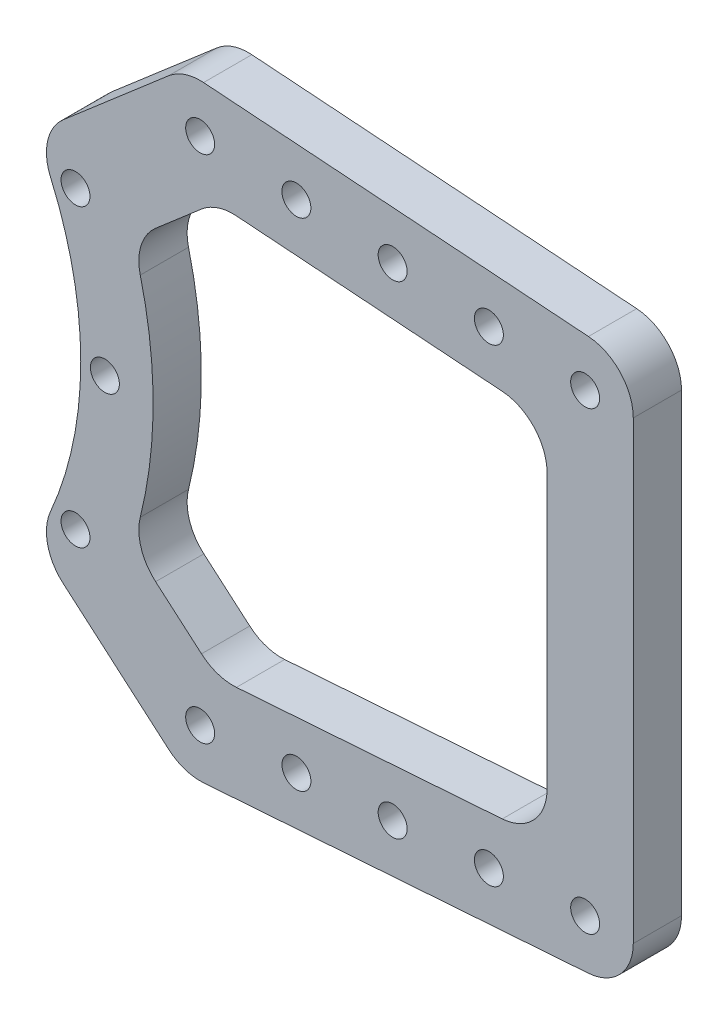
from build123d import *

# Parameters (mm, degrees)
EXTRUDE_1_DEPTH     = 15
FILLET_1_R          = 5
FILLET_2_R          = 5
FILLET_3_R          = 5
FILLET_4_R          = 5
FILLET_5_R          = 5
FILLET_6_R          = 5
FILLET_7_R          = 5
FILLET_8_R          = 5
FILLET_9_R          = 5
FILLET_10_R         = 5
FILLET_11_R         = 5
FILLET_12_R         = 5
FILLET_13_R         = 5
FILLET_14_R         = 5
FILLET_15_R         = 5
FILLET_16_R         = 5
SKETCH_5_R          = 1.5
CUT_EXTRUDE_1_DEPTH = 15
CUT_EXTRUDE_START   = -15
SKETCH_6_R          = 1.5
CUT_EXTRUDE_5_DEPTH = 15
EXTRUDE_2_DEPTH     = 15
FILLET_17_R         = 5
FILLET_18_R         = 5
FILLET_19_R         = 5
FILLET_20_R         = 5
SKETCH_8_W          = 96.520141499
SKETCH_8_H          = 72.316132992
CUT_EXTRUDE_6_DEPTH = 5
SKETCH_9_W          = 91.216327174
SKETCH_9_H          = 79.967676963
CUT_EXTRUDE_7_DEPTH = 5


with BuildPart() as part:
    # 草图3 → 凸台-拉伸1 (new body)
    with BuildSketch(Plane.XY):
        with BuildLine():
            Line((101.99145665, -27.727634828), (114.18506552, -15.283623844))
            ThreePointArc((114.18506552, -15.283623844), (110, 0), (114.18506552, 15.283623844))
            Line((114.18506552, 15.283623844), (101.99145665, 27.727634828))
            Line((101.99145665, 27.727634828), (48.171786379, 31.57189699))
            Line((48.171786379, 31.57189699), (32.743622368, 18.278544642))
            ThreePointArc((32.743622368, 18.278544642), (37.5, 0), (32.743622368, -18.278544642))
            Line((32.743622368, -18.278544642), (48.171786379, -31.57189699))
            Line((48.171786379, -31.57189699), (101.99145665, -27.727634828))
        make_face()
        with BuildLine():
            ThreePointArc((42.839131819, -13.777110909), (45, 0), (42.839131819, 13.777110909))
            Line((42.839131819, 13.777110909), (51.574083604, 21.303398011))
            Line((51.574083604, 21.303398011), (97.500283316, 18.022955175))
            Line((97.500283316, 18.022955175), (106.212331228, 9.132000819))
            ThreePointArc((106.212331228, 9.132000819), (105, 0), (106.212331228, -9.132000819))
            Line((106.212331228, -9.132000819), (97.500283316, -18.022955175))
            Line((97.500283316, -18.022955175), (51.574083604, -21.303398011))
            Line((51.574083604, -21.303398011), (42.839131819, -13.777110909))
        make_face(mode=Mode.SUBTRACT)
    extrude(amount=EXTRUDE_1_DEPTH)

    # 圆角1
    fillet_1_edges = [part.edges().sort_by_distance(p)[0] for p in [
        (101.99145665, 27.727634828, 7.5),
    ]]
    fillet(fillet_1_edges, radius=FILLET_1_R)

    # 圆角2
    fillet_2_edges = [part.edges().sort_by_distance(p)[0] for p in [
        (114.18506552, 15.283623844, 7.5),
    ]]
    fillet(fillet_2_edges, radius=FILLET_2_R)

    # 圆角3
    fillet_3_edges = [part.edges().sort_by_distance(p)[0] for p in [
        (114.18506552, -15.283623844, 7.5),
    ]]
    fillet(fillet_3_edges, radius=FILLET_3_R)

    # 圆角4
    fillet_4_edges = [part.edges().sort_by_distance(p)[0] for p in [
        (101.99145665, -27.727634828, 7.5),
    ]]
    fillet(fillet_4_edges, radius=FILLET_4_R)

    # 圆角5
    fillet_5_edges = [part.edges().sort_by_distance(p)[0] for p in [
        (48.171786379, -31.57189699, 7.5),
    ]]
    fillet(fillet_5_edges, radius=FILLET_5_R)

    # 圆角6
    fillet_6_edges = [part.edges().sort_by_distance(p)[0] for p in [
        (48.171786379, 31.57189699, 7.5),
    ]]
    fillet(fillet_6_edges, radius=FILLET_6_R)

    # 圆角7
    fillet_7_edges = [part.edges().sort_by_distance(p)[0] for p in [
        (32.743622368, -18.278544642, 7.5),
    ]]
    fillet(fillet_7_edges, radius=FILLET_7_R)

    # 圆角8
    fillet_8_edges = [part.edges().sort_by_distance(p)[0] for p in [
        (32.743622368, 18.278544642, 7.5),
    ]]
    fillet(fillet_8_edges, radius=FILLET_8_R)

    # 圆角9
    fillet_9_edges = [part.edges().sort_by_distance(p)[0] for p in [
        (97.500283316, -18.022955175, 7.5),
    ]]
    fillet(fillet_9_edges, radius=FILLET_9_R)

    # 圆角10
    fillet_10_edges = [part.edges().sort_by_distance(p)[0] for p in [
        (106.212331228, -9.132000819, 7.5),
    ]]
    fillet(fillet_10_edges, radius=FILLET_10_R)

    # 圆角11
    fillet_11_edges = [part.edges().sort_by_distance(p)[0] for p in [
        (106.212331228, 9.132000819, 7.5),
    ]]
    fillet(fillet_11_edges, radius=FILLET_11_R)

    # 圆角12
    fillet_12_edges = [part.edges().sort_by_distance(p)[0] for p in [
        (97.500283316, 18.022955175, 7.5),
    ]]
    fillet(fillet_12_edges, radius=FILLET_12_R)

    # 圆角13
    fillet_13_edges = [part.edges().sort_by_distance(p)[0] for p in [
        (51.574083604, -21.303398011, 7.5),
    ]]
    fillet(fillet_13_edges, radius=FILLET_13_R)

    # 圆角14
    fillet_14_edges = [part.edges().sort_by_distance(p)[0] for p in [
        (42.839131819, -13.777110909, 7.5),
    ]]
    fillet(fillet_14_edges, radius=FILLET_14_R)

    # 圆角15
    fillet_15_edges = [part.edges().sort_by_distance(p)[0] for p in [
        (42.839131819, 13.777110909, 7.5),
    ]]
    fillet(fillet_15_edges, radius=FILLET_15_R)

    # 圆角16
    fillet_16_edges = [part.edges().sort_by_distance(p)[0] for p in [
        (51.574083604, 21.303398011, 7.5),
    ]]
    fillet(fillet_16_edges, radius=FILLET_16_R)

    # 草图5 → 切除-拉伸1 (cut)
    with BuildSketch(Plane(origin=(0, 0, 0), x_dir=(-1, 0, 0), z_dir=(0, 0, -1))):
        with Locations((-36.9551813, 15.307337295)):
            Circle(SKETCH_5_R)
        with Locations((-40, 0)):
            Circle(SKETCH_5_R)
        with Locations((-36.9551813, -15.307337295)):
            Circle(SKETCH_5_R)
        with Locations((-49.872934992, -26.437647501)):
            Circle(SKETCH_5_R)
        with Locations((-49.872934992, 26.437647501)):
            Circle(SKETCH_5_R)
        with Locations((-99.745869983, 22.875295001)):
            Circle(SKETCH_5_R)
        with Locations((-99.745869983, -22.875295001)):
            Circle(SKETCH_5_R)
        with Locations((-109.973915193, 12.437211552)):
            Circle(SKETCH_5_R)
        with Locations((-107.5, 0)):
            Circle(SKETCH_5_R)
        with Locations((-109.973915193, -12.437211552)):
            Circle(SKETCH_5_R)
        with Locations((-59.84752199, 25.725177001)):
            Circle(SKETCH_5_R)
        with Locations((-69.822108988, 25.012706501)):
            Circle(SKETCH_5_R)
        with Locations((-79.796695986, 24.300236001)):
            Circle(SKETCH_5_R)
        with Locations((-89.771282985, 23.587765501)):
            Circle(SKETCH_5_R)
        with Locations((-89.771282985, -23.587765501)):
            Circle(SKETCH_5_R)
        with Locations((-79.796695986, -24.300236001)):
            Circle(SKETCH_5_R)
        with Locations((-69.822108988, -25.012706501)):
            Circle(SKETCH_5_R)
        with Locations((-59.84752199, -25.725177001)):
            Circle(SKETCH_5_R)
    extrude(amount=-CUT_EXTRUDE_1_DEPTH, mode=Mode.SUBTRACT)

    # 草图6 → 切除-拉伸5 (cut)
    # profile 1 of 5: a face of its own
    with BuildSketch(Plane.XY.offset(15).offset(CUT_EXTRUDE_START)):
        with BuildLine():
            ThreePointArc((103.31715251, 26.374715112), (101.845820167, 27.412938577), (100.102105233, 27.8625885))
            Line((100.102105233, 27.8625885), (100.102105233, 24.332379915))
            ThreePointArc((100.102105233, 24.332379915), (100.925775249, 23.801482651), (101.245869983, 22.875295001))
            ThreePointArc((101.245869983, 22.875295001), (100.925775249, 21.949107351), (100.102105233, 21.418210087))
            Line((100.102105233, 21.418210087), (100.102105233, 15.367703489))
            Line((100.102105233, 15.367703489), (104.297377986, 11.086278624))
            ThreePointArc((104.297377986, 11.086278624), (105.514152308, 9.027175008), (105.635333526, 6.638501199))
            ThreePointArc((105.635333526, 6.638501199), (105, 0), (105.635333526, -6.638501199))
            ThreePointArc((105.635333526, -6.638501199), (105.514152308, -9.027175008), (104.297377986, -11.086278624))
            Line((104.297377986, -11.086278624), (100.102105233, -15.367703489))
            Line((100.102105233, -15.367703489), (100.102105233, -21.418210087))
            ThreePointArc((100.102105233, -21.418210087), (100.925775249, -21.949107351), (101.245869983, -22.875295001))
            ThreePointArc((101.245869983, -22.875295001), (100.925775249, -23.801482651), (100.102105233, -24.332379915))
            Line((100.102105233, -24.332379915), (100.102105233, -27.8625885))
            ThreePointArc((100.102105233, -27.8625885), (101.845820167, -27.412938577), (103.31715251, -26.374715112))
            Line((103.31715251, -26.374715112), (111.655402821, -17.865234485))
            ThreePointArc((111.655402821, -17.865234485), (113.00675492, -15.241981218), (112.643531681, -12.313555178))
            ThreePointArc((112.643531681, -12.313555178), (110, 0), (112.643531681, 12.313555178))
            ThreePointArc((112.643531681, 12.313555178), (113.00675492, 15.241981218), (111.655402821, 17.865234485))
            Line((111.655402821, 17.865234485), (103.31715251, 26.374715112))
        make_face()
        with Locations((109.973915193, -12.437211552)):
            Circle(SKETCH_6_R, mode=Mode.SUBTRACT)
        with Locations((107.5, 0)):
            Circle(SKETCH_6_R, mode=Mode.SUBTRACT)
        with Locations((109.973915193, 12.437211552)):
            Circle(SKETCH_6_R, mode=Mode.SUBTRACT)
    # profile 2 of 5: a face of its own
    with BuildSketch(Plane.XY.offset(15).offset(CUT_EXTRUDE_START)):
        with BuildLine():
            Line((100.102105233, -21.418210087), (100.102105233, -15.367703489))
            Line((100.102105233, -15.367703489), (98.825979176, -16.670035459))
            ThreePointArc((98.825979176, -16.670035459), (97.354646834, -17.708258924), (95.610931899, -18.157908847))
            Line((95.610931899, -18.157908847), (94.758576484, -18.218791377))
            Line((94.758576484, -18.218791377), (94.758576484, -23.231530251))
            Line((94.758576484, -23.231530251), (98.249681933, -22.982165576))
            ThreePointArc((98.249681933, -22.982165576), (98.778211836, -21.729154647), (100.102105233, -21.418210087))
        make_face()
    # profile 3 of 5: a face of its own
    with BuildSketch(Plane.XY.offset(15).offset(CUT_EXTRUDE_START)):
        with BuildLine():
            Line((94.758576484, -28.244269125), (100.102105233, -27.8625885))
            Line((100.102105233, -27.8625885), (100.102105233, -24.332379915))
            ThreePointArc((100.102105233, -24.332379915), (98.862330065, -24.087465457), (98.249681933, -22.982165576))
            Line((98.249681933, -22.982165576), (94.758576484, -23.231530251))
            Line((94.758576484, -23.231530251), (94.758576484, -28.244269125))
        make_face()
    # profile 4 of 5: a face of its own
    with BuildSketch(Plane.XY.offset(15).offset(CUT_EXTRUDE_START)):
        with BuildLine():
            Line((100.102105233, 15.367703489), (100.102105233, 21.418210087))
            ThreePointArc((100.102105233, 21.418210087), (98.778211836, 21.729154647), (98.249681933, 22.982165576))
            Line((98.249681933, 22.982165576), (94.758576484, 23.231530251))
            Line((94.758576484, 23.231530251), (94.758576484, 18.218791377))
            Line((94.758576484, 18.218791377), (95.610931899, 18.157908847))
            ThreePointArc((95.610931899, 18.157908847), (97.354646834, 17.708258924), (98.825979176, 16.670035459))
            Line((98.825979176, 16.670035459), (100.102105233, 15.367703489))
        make_face()
    # profile 5 of 5: a face of its own
    with BuildSketch(Plane.XY.offset(15).offset(CUT_EXTRUDE_START)):
        with BuildLine():
            Line((100.102105233, 24.332379915), (100.102105233, 27.8625885))
            Line((100.102105233, 27.8625885), (94.758576484, 28.244269125))
            Line((94.758576484, 28.244269125), (94.758576484, 23.231530251))
            Line((94.758576484, 23.231530251), (98.249681933, 22.982165576))
            ThreePointArc((98.249681933, 22.982165576), (98.862330065, 24.087465457), (100.102105233, 24.332379915))
        make_face()
    extrude(amount=CUT_EXTRUDE_5_DEPTH, mode=Mode.SUBTRACT)

    # 草图7 → 凸台-拉伸2 (add)
    with BuildSketch(Plane.XY.offset(15)):
        Polygon((94.758576484, -18.218791377), (94.758576484, 18.218791377), (85.826771952, 18.856777415), (85.826771952, -18.856777415), align=None)
    extrude(amount=-EXTRUDE_2_DEPTH)

    # 圆角17
    fillet_17_edges = [part.edges().sort_by_distance(p)[0] for p in [
        (94.758576484, 28.244269125, 7.5),
    ]]
    fillet(fillet_17_edges, radius=FILLET_17_R)

    # 圆角18
    fillet_18_edges = [part.edges().sort_by_distance(p)[0] for p in [
        (94.758576484, -28.244269125, 7.5),
    ]]
    fillet(fillet_18_edges, radius=FILLET_18_R)

    # 圆角19
    fillet_19_edges = [part.edges().sort_by_distance(p)[0] for p in [
        (85.826771952, 18.856777415, 7.5),
    ]]
    fillet(fillet_19_edges, radius=FILLET_19_R)

    # 圆角20
    fillet_20_edges = [part.edges().sort_by_distance(p)[0] for p in [
        (85.826771952, -18.856777415, 7.5),
    ]]
    fillet(fillet_20_edges, radius=FILLET_20_R)

    # 草图8 → 切除-拉伸6 (cut)
    with BuildSketch(Plane(origin=(0, 0, 0), x_dir=(-1, 0, 0), z_dir=(0, 0, -1))):
        with Locations((-67.250576804, -3.787424314)):
            Rectangle(SKETCH_8_W, SKETCH_8_H)
    extrude(amount=-CUT_EXTRUDE_6_DEPTH, mode=Mode.SUBTRACT)

    # 草图9 → 切除-拉伸7 (cut)
    with BuildSketch(Plane.XY.offset(15)):
        with Locations((64.504220749, 0.715823196)):
            Rectangle(SKETCH_9_W, SKETCH_9_H)
    extrude(amount=-CUT_EXTRUDE_7_DEPTH, mode=Mode.SUBTRACT)


solid = part.part
